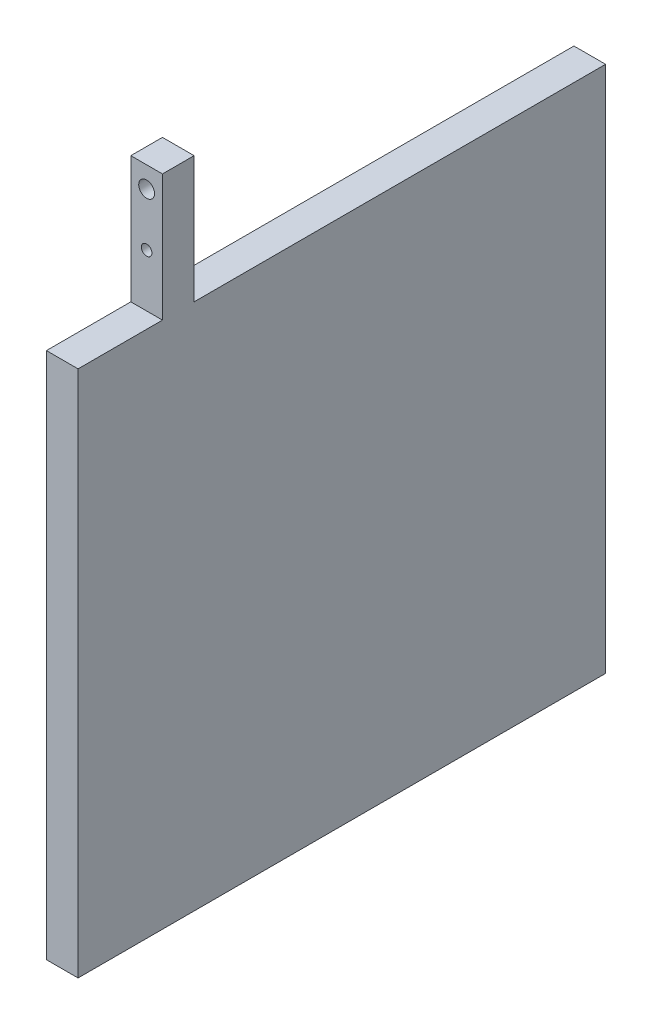
from build123d import *

# Parameters (mm, degrees)
BOSS_EXTRUDE1_DEPTH = 3
SKETCH2_R           = 0.75
SKETCH2_R_2         = 0.5
CUT_EXTRUDE1_DEPTH  = 10


with BuildPart() as part:
    # Sketch1 → Boss-Extrude1 (new body)
    with BuildSketch(Plane(origin=(0, 0, 0), x_dir=(0, 0, -1), z_dir=(1, 0, 0))):
        Polygon((0, 0), (0, -12), (-8, -12), (-8, -62), (42, -62), (42, -12), (3, -12), (3, 0), align=None)
    extrude(amount=BOSS_EXTRUDE1_DEPTH)

    # Sketch2 → Cut-Extrude1 (cut)
    with BuildSketch(Plane.XY):
        with Locations((1.5, -2)):
            Circle(SKETCH2_R)
        with Locations((1.5, -7)):
            Circle(SKETCH2_R_2)
    extrude(amount=-CUT_EXTRUDE1_DEPTH, mode=Mode.SUBTRACT)


solid = part.part
